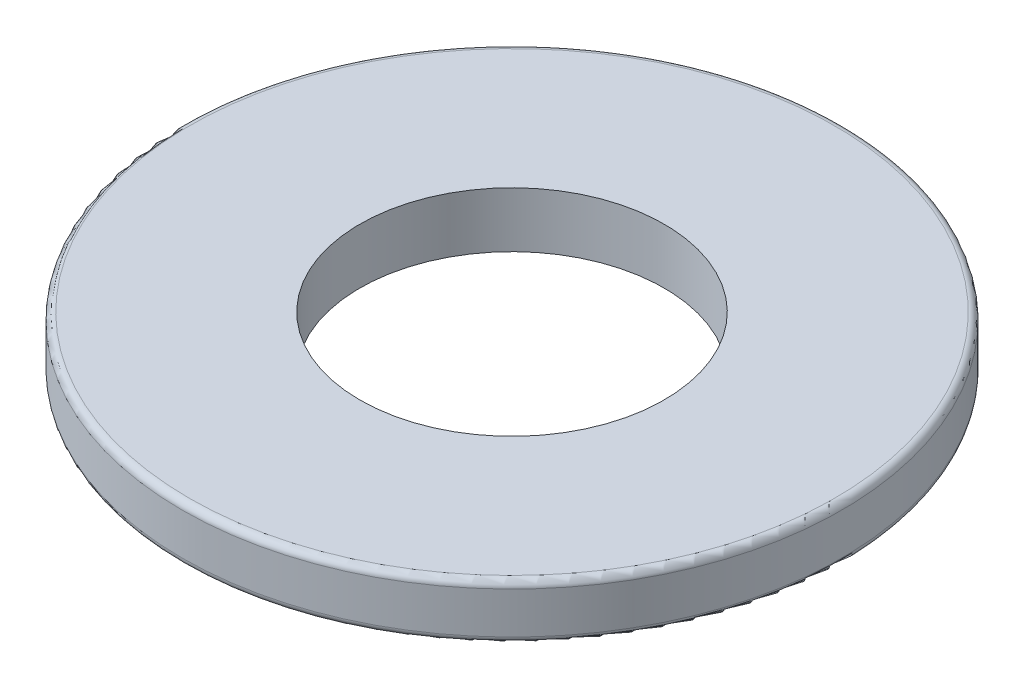
from build123d import *

# Parameters (mm, degrees)
ESBO_O1_R                = 4.7625
ESBO_O1_R_2              = 2.2
RESSALTO_EXTRUS_O1_DEPTH = 0.8
FILETE1_R                = 0.1


with BuildPart() as part:
    # Esboço1 → Ressalto-extrusão1 (new body)
    with BuildSketch(Plane(origin=(0, 0, 0), x_dir=(1, 0, 0), z_dir=(0, 1, 0))):
        with Locations(Location((0, 0, 0), (0, 0, 270))):
            Circle(ESBO_O1_R)
        with Locations(Location((0, 0, 0), (0, 0, 270))):
            Circle(ESBO_O1_R_2, mode=Mode.SUBTRACT)
    extrude(amount=RESSALTO_EXTRUS_O1_DEPTH)

    # Filete1
    filete1_edges = [part.edges().sort_by_distance(p)[0] for p in [
        (0, 0, -4.7625),
        (0, 0.8, -4.7625),
    ]]
    fillet(filete1_edges, radius=FILETE1_R)


solid = part.part
